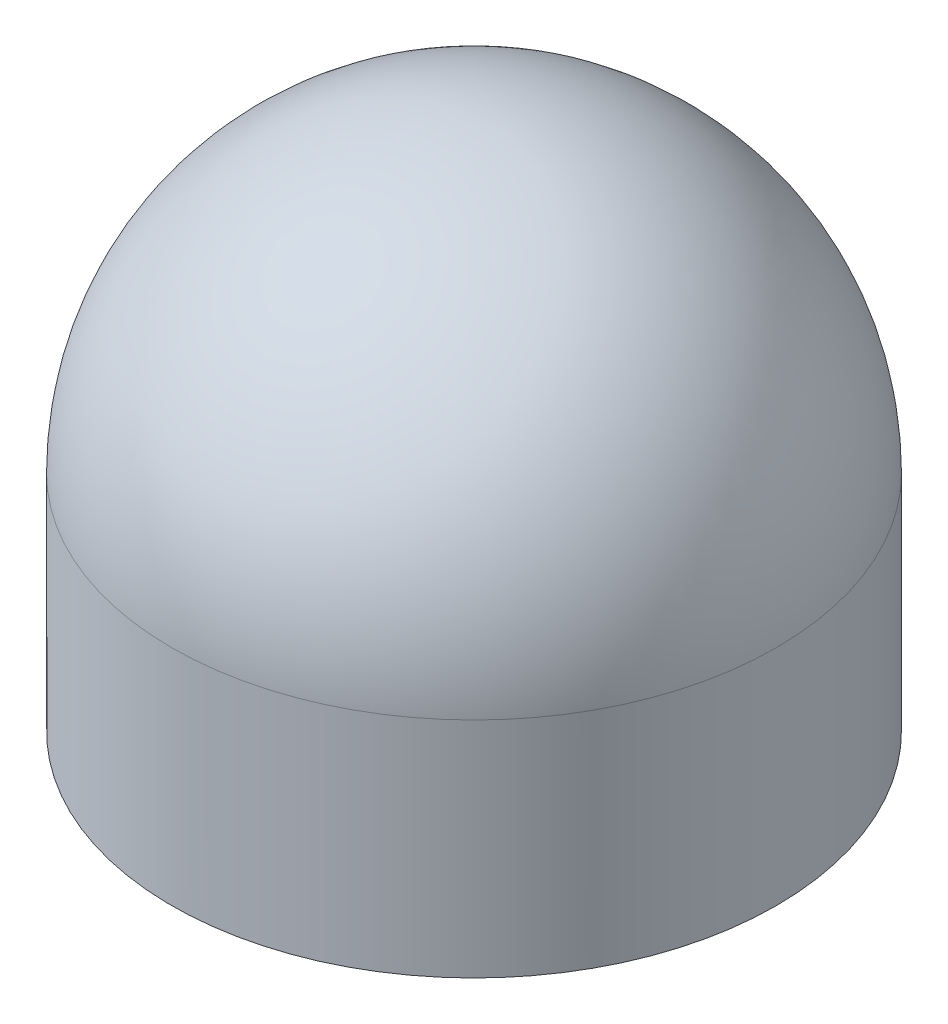
from build123d import *


with BuildPart() as part:
    # Szkic1 → Obrót1 (revolve)
    with BuildSketch(Plane.XY):
        with BuildLine():
            Line((-11.5, 0), (-11.5, 8.5))
            ThreePointArc((-11.5, 8.5), (-8.131727984, 16.631727984), (0, 20))
            Line((0, 20), (0, 18.5))
            ThreePointArc((0, 18.5), (-7.071067812, 15.571067812), (-10, 8.5))
            Line((-10, 8.5), (-10, 0))
            Line((-10, 0), (-11.5, 0))
        make_face()
    revolve(axis=Axis((0, 0, 0), (0, 1, 0)))


solid = part.part
